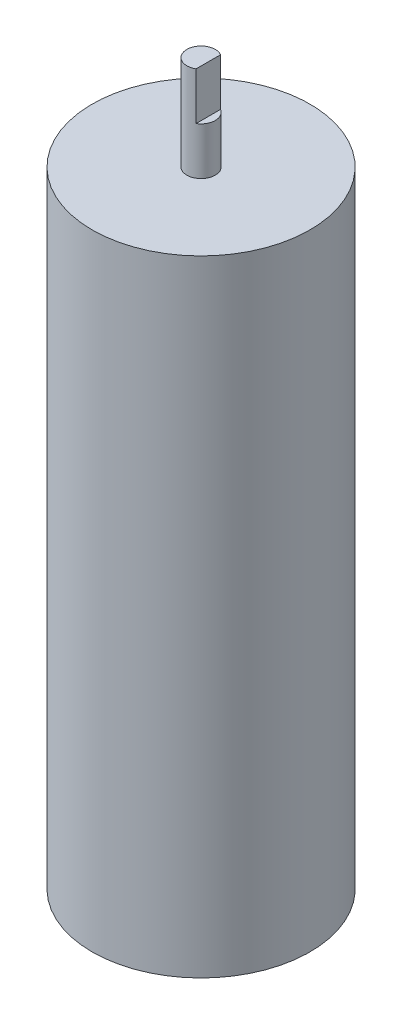
from build123d import *

# Parameters (mm, degrees)
SKETCH1_R           = 11.5
BOSS_EXTRUDE1_DEPTH = 66
SKETCH2_R           = 1.5
BOSS_EXTRUDE2_DEPTH = 10
BOSS_EXTRUDE4_START = 6
SKETCH4_R           = 1.5
BOSS_EXTRUDE4_DEPTH = 6
FILLET1_R           = 0.5
CUT_EXTRUDE1_START  = -5
CUT_EXTRUDE1_DEPTH  = 5


with BuildPart() as part:
    # Sketch1 → Boss-Extrude1 (new body)
    with BuildSketch(Plane(origin=(0, 0, 0), x_dir=(1, 0, 0), z_dir=(0, 1, 0))):
        with Locations(Location((0, 0, 0), (0, 0, 270))):
            Circle(SKETCH1_R)
    extrude(amount=BOSS_EXTRUDE1_DEPTH)

    # Sketch2 → Boss-Extrude2 (add)
    with BuildSketch(Plane(origin=(0, 66, 0), x_dir=(1, 0, 0), z_dir=(0, 1, 0))):
        with Locations(Location((0, 0, 0), (0, 0, 270))):
            Circle(SKETCH2_R)
    extrude(amount=BOSS_EXTRUDE2_DEPTH)

    # Sketch4 → Boss-Extrude4 (add)
    with BuildSketch(Plane.XZ.offset(BOSS_EXTRUDE4_START)):
        with Locations(Location((0, 0, 0), (0, 0, 90))):
            Circle(SKETCH4_R)
    extrude(amount=-BOSS_EXTRUDE4_DEPTH)

    # Fillet1
    fillet1_edges = [part.edges().sort_by_distance(p)[0] for p in [
        (0, -6, -1.5),
    ]]
    fillet(fillet1_edges, radius=FILLET1_R)

    # Sketch5 → Cut-Extrude1 (cut)
    with BuildSketch(Plane(origin=(0, 76, 0), x_dir=(1, 0, 0), z_dir=(0, 1, 0)).offset(CUT_EXTRUDE1_START)):
        with BuildLine():
            Line((0.765599936, 1.289905709), (0.765599936, -1.289905709))
            ThreePointArc((0.765599936, -1.289905709), (1.5, 0), (0.765599936, 1.289905709))
        make_face()
    extrude(amount=CUT_EXTRUDE1_DEPTH, mode=Mode.SUBTRACT)


solid = part.part
